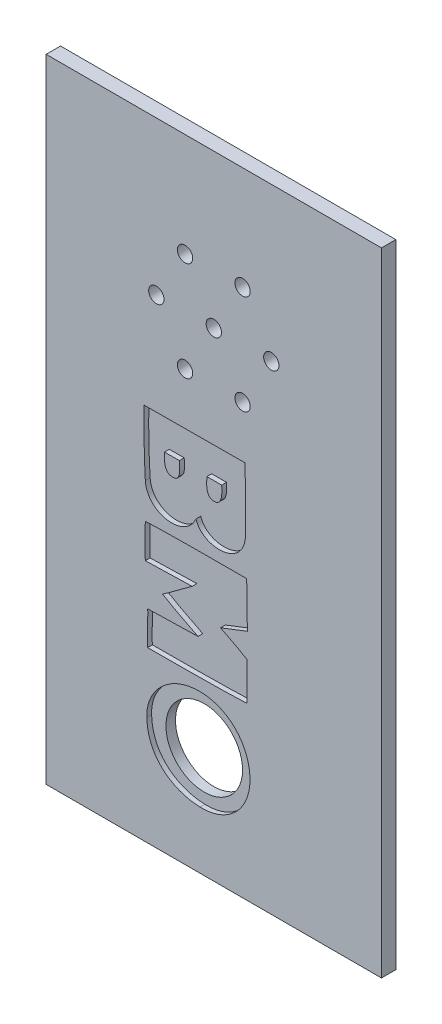
from build123d import *

# Parameters (mm, degrees)
SKETCH1_W           = 70
SKETCH1_H           = 132
BOSS_EXTRUDE1_DEPTH = 3
SKETCH2_R           = 1.6
SKETCH2_R_2         = 8
CUT_EXTRUDE1_DEPTH  = 75.76630257
CUT_EXTRUDE4_DEPTH  = 1


with BuildPart() as part:
    # Sketch1 → Boss-Extrude1 (new body)
    with BuildSketch(Plane.XY):
        Rectangle(SKETCH1_W, SKETCH1_H)
    extrude(amount=BOSS_EXTRUDE1_DEPTH)

    # Sketch2 → Cut-Extrude1 (cut, through all)
    with BuildSketch(Plane.XY.offset(3)):
        with Locations((0, 34)):
            Circle(SKETCH2_R)
        with Locations((12, 34)):
            Circle(SKETCH2_R)
        with Locations((6, 23.607695155)):
            Circle(SKETCH2_R)
        with Locations((-6, 23.607695155)):
            Circle(SKETCH2_R)
        with Locations((-12, 34)):
            Circle(SKETCH2_R)
        with Locations((-6, 44.392304845)):
            Circle(SKETCH2_R)
        with Locations((6, 44.392304845)):
            Circle(SKETCH2_R)
        with Locations((-3, -43.897608135)):
            Circle(SKETCH2_R_2)
    extrude(amount=-CUT_EXTRUDE1_DEPTH, mode=Mode.SUBTRACT)

    # Sketch4 → Cut-Extrude4 (cut)
    # profile 1 of 3: a face of its own
    with BuildSketch(Plane.XY.offset(3)):
        with BuildLine():
            Line((6.45851265, 12.906743281), (-14.568183267, 12.79048604))
            add(Edge.make_bspline(
                [(-14.568183267, 12.79048604), (-14.681147025, 8.885776406), (-14.479455132, 1.79384743), (-14.301868244, -0.700797834)],
                knots=[3, 3, 3, 3, 4, 4, 4, 4], degree=3))
            add(Edge.make_bspline(
                [(-14.301868244, -0.700797834), (-13.90467122, -6.293112042), (-6.02841872, -7.493806409), (-3.714842898, -2.357422472)],
                knots=[4, 4, 4, 4, 5, 5, 5, 5], degree=3))
            add(Edge.make_bspline(
                [(-3.714842898, -2.357422472), (-2.329345092, -6.937264415), (6.351806367, -6.654110228), (6.60038457, -0.371389262)],
                knots=[0, 0, 0, 0, 1, 1, 1, 1], degree=3))
            add(Edge.make_bspline(
                [(6.60038457, -0.371389262), (6.680360064, 1.669518266), (6.677206871, 9.68502366), (6.45851265, 12.906743281)],
                knots=[1, 1, 1, 1, 2, 2, 2, 2], degree=3))
        make_face()
        with BuildLine():
            Line((-10.303353065, 6.425883244), (-7.183572594, 6.455631236))
            add(Edge.make_bspline(
                [(-7.183572594, 6.455631236), (-7.050887386, 4.572236089), (-6.992141879, 2.842101206), (-8.396768449, 2.766134029)],
                knots=[1, 1, 1, 1, 2, 2, 2, 2], degree=3))
            add(Edge.make_bspline(
                [(-8.396768449, 2.766134029), (-9.950124995, 2.682447476), (-10.470564902, 3.948173451), (-10.303353065, 6.425883244)],
                knots=[2, 2, 2, 2, 3, 3, 3, 3], degree=3))
        make_face(mode=Mode.SUBTRACT)
        with BuildLine():
            Line((-1.455563307, 6.43862815), (1.642620722, 6.437735553))
            add(Edge.make_bspline(
                [(1.642620722, 6.437735553), (1.778020818, 4.557137064), (1.614080218, 2.787865388), (0.209453648, 2.711898211)],
                knots=[1, 1, 1, 1, 2, 2, 2, 2], degree=3))
            add(Edge.make_bspline(
                [(0.209453648, 2.711898211), (-1.341188011, 2.631008317), (-1.625571802, 3.963633245), (-1.455563307, 6.43862815)],
                knots=[2, 2, 2, 2, 3, 3, 3, 3], degree=3))
        make_face(mode=Mode.SUBTRACT)
    # profile 2 of 3: a face of its own
    with BuildSketch(Plane.XY.offset(3)):
        with BuildLine():
            add(Edge.make_bspline(
                [(-2.610093021, -33.160113435), (3.440856804, -33.392835626), (7.468225103, -38.057518842), (7.552654108, -43.748190308), (7.637123998, -49.441617546), (3.166137779, -54.262705816), (-2.884812046, -54.029983625)],
                knots=[2, 2, 2, 2, 3, 3, 3, 4, 4, 4, 4], degree=3))
            add(Edge.make_bspline(
                [(-2.884812046, -54.029983625), (-8.938558529, -53.794546546), (-13.860187809, -49.978313982), (-13.995201607, -43.29333994)],
                knots=[0, 0, 0, 0, 1, 1, 1, 1], degree=3))
            add(Edge.make_bspline(
                [(-13.995201607, -43.29333994), (-14.110025888, -37.597606671), (-8.663798619, -32.927432129), (-2.610093021, -33.160113435)],
                knots=[1, 1, 1, 1, 2, 2, 2, 2], degree=3))
        make_face()
    # profile 3 of 3: a face of its own
    with BuildSketch(Plane.XY.offset(3)):
        with BuildLine():
            add(Edge.make_bspline(
                [(-14.291870327, -8.062939687), (-10.383022832, -7.897447705), (2.091241678, -7.822629876), (6.863120355, -7.862087625)],
                knots=[11, 11, 11, 11, 12, 12, 12, 12], degree=3))
            add(Edge.make_bspline(
                [(6.863120355, -7.862087625), (6.884380927, -9.29508964), (6.98209779, -15.881387365), (7.003317477, -17.311633608)],
                knots=[0, 0, 0, 0, 1, 1, 1, 1], degree=3))
            add(Edge.make_bspline(
                [(7.003317477, -17.311633608), (5.78621416, -17.765199017), (2.137823528, -19.13687745), (1.406938394, -19.47848671)],
                knots=[1, 1, 1, 1, 2, 2, 2, 2], degree=3))
            add(Edge.make_bspline(
                [(1.406938394, -19.47848671), (3.131316037, -20.332188301), (6.337604175, -22.045945199), (6.958601521, -22.472239835)],
                knots=[2, 2, 2, 2, 3, 3, 3, 3], degree=3))
            add(Edge.make_bspline(
                [(6.958601521, -22.472239835), (7.001000009, -25.329976547), (6.932864564, -29.283635925), (6.949137079, -30.380433621)],
                knots=[3, 3, 3, 3, 4, 4, 4, 4], degree=3))
            add(Edge.make_bspline(
                [(6.949137079, -30.380433621), (1.818402638, -30.67706556), (-12.366076626, -30.667001608), (-13.834903692, -30.688793695)],
                knots=[4, 4, 4, 4, 5, 5, 5, 5], degree=3))
            add(Edge.make_bspline(
                [(-13.834903692, -30.688793695), (-13.98706731, -28.607228198), (-13.681976263, -24.647296875), (-13.817990024, -23.654261755)],
                knots=[5, 5, 5, 5, 6, 6, 6, 6], degree=3))
            add(Edge.make_bspline(
                [(-13.817990024, -23.654261755), (-10.761837648, -23.608919496), (-4.893594588, -23.417113542), (-3.303513506, -23.393522483)],
                knots=[6, 6, 6, 6, 7, 7, 7, 7], degree=3))
            add(Edge.make_bspline(
                [(-3.303513506, -23.393522483), (-6.752268792, -21.686119301), (-9.714372582, -20.081751157), (-10.699728834, -19.434839155)],
                knots=[7, 7, 7, 7, 8, 8, 8, 8], degree=3))
            add(Edge.make_bspline(
                [(-10.699728834, -19.434839155), (-8.641378398, -18.089507553), (-5.621082796, -15.627352279), (-4.528545239, -14.952368219)],
                knots=[8, 8, 8, 8, 9, 9, 9, 9], degree=3))
            add(Edge.make_bspline(
                [(-4.528545239, -14.952368219), (-9.175858156, -15.134329121), (-13.207554211, -15.194144924), (-14.309863454, -15.21049921)],
                knots=[9, 9, 9, 9, 10, 10, 10, 10], degree=3))
            add(Edge.make_bspline(
                [(-14.309863454, -15.21049921), (-14.332718569, -13.670022044), (-14.402796688, -8.946626939), (-14.291870327, -8.062939687)],
                knots=[10, 10, 10, 10, 11, 11, 11, 11], degree=3))
        make_face()
    extrude(amount=-CUT_EXTRUDE4_DEPTH, mode=Mode.SUBTRACT)


solid = part.part
